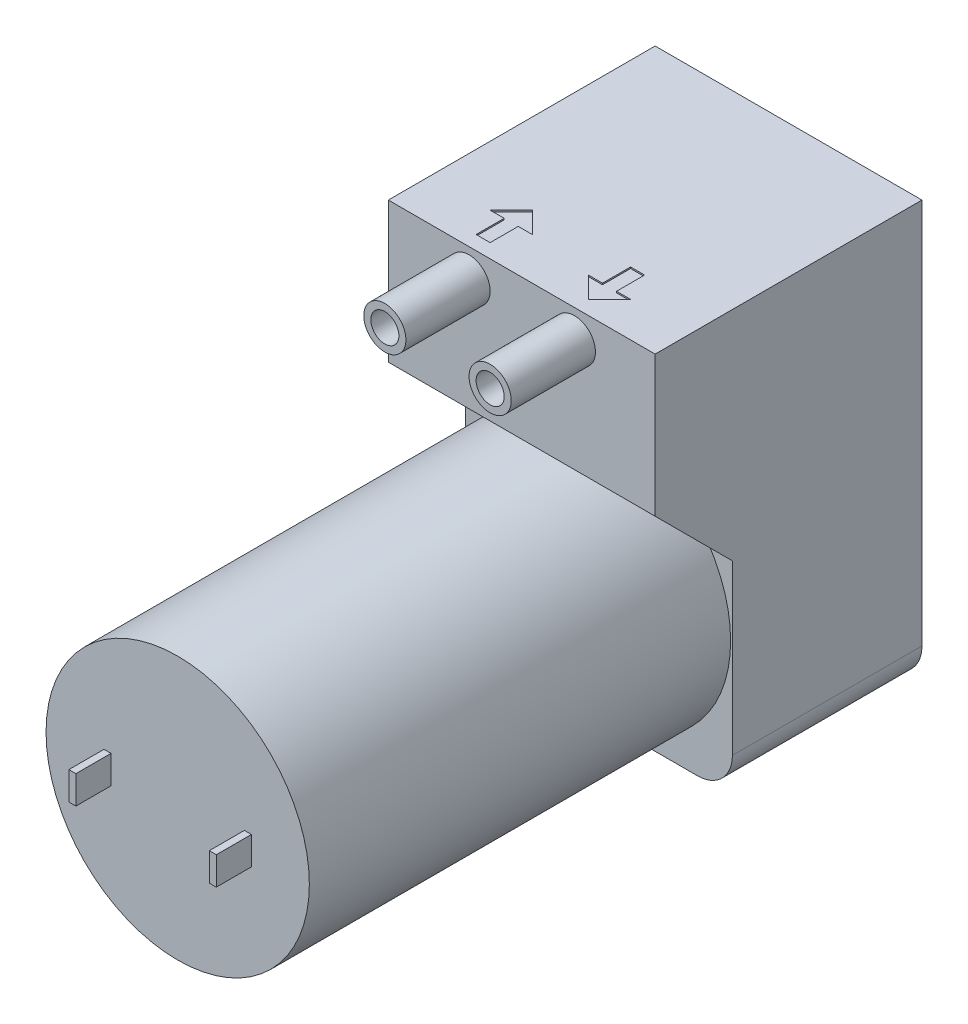
from build123d import *

# Parameters (mm, degrees)
SKETCH1_W      = 38
SKETCH1_H      = 60
EXTRUDE1_DEPTH = 38
EXTRUDE2_DEPTH = 68.594378464
FILLET1_R      = 5
SKETCH3_R      = 18.75
EXTRUDE3_DEPTH = 60
SKETCH4_R      = 3
SKETCH4_R_2    = 2
EXTRUDE4_DEPTH = 12
EXTRUDE5_DEPTH = 0.2
SKETCH6_W      = 1
SKETCH6_H      = 4
EXTRUDE6_DEPTH = 5


with BuildPart() as part:
    # Sketch1 → Extrude1 (new body)
    with BuildSketch(Plane.XY):
        with Locations((0, 11)):
            Rectangle(SKETCH1_W, SKETCH1_H)
    extrude(amount=EXTRUDE1_DEPTH)

    # Sketch2 → Extrude2 (cut, through all)
    with BuildSketch(Plane(origin=(19, 0, 0), x_dir=(0, 0, -1), z_dir=(1, 0, 0))):
        Polygon((-38, -19), (-27, -19), (-27, 10), (-38, 21), align=None)
    extrude(amount=-EXTRUDE2_DEPTH, mode=Mode.SUBTRACT)

    # Fillet1
    fillet1_edges = [part.edges().sort_by_distance(p)[0] for p in [
        (-19, -19, 13.5),
        (19, -19, 13.5),
    ]]
    fillet(fillet1_edges, radius=FILLET1_R)

    # Sketch4 → Extrude4 (add)
    # profile 1 of 2: a face of its own
    with BuildSketch(Plane.XY.offset(38)):
        with Locations(Location((-7.5, 37, 0), (0, 0, 180))):
            Circle(SKETCH4_R)
        with Locations((-7.5, 37)):
            Circle(SKETCH4_R_2, mode=Mode.SUBTRACT)
    # profile 2 of 2: a face of its own
    with BuildSketch(Plane.XY.offset(38)):
        with Locations(Location((7.5, 37, 0), (0, 0, 180))):
            Circle(SKETCH4_R)
        with Locations(Location((7.5, 37, 0), (0, 0, 180))):
            Circle(SKETCH4_R_2, mode=Mode.SUBTRACT)
    extrude(amount=EXTRUDE4_DEPTH)

    # Sketch5 → Extrude5 (cut)
    with BuildSketch(Plane(origin=(0, 41, 0), x_dir=(1, 0, 0), z_dir=(0, 1, 0))):
        Polygon((-8.5, -36), (-8.5, -32), (-10.5, -32), (-7.5, -29), (-4.5, -32), (-6.5, -32), (-6.5, -36), align=None)
        Polygon((6.5, -29), (8.5, -29), (8.5, -33), (10.5, -33), (7.5, -36), (4.5, -33), (6.5, -33), align=None)
    extrude(amount=-EXTRUDE5_DEPTH, mode=Mode.SUBTRACT)


with BuildPart() as body_2:
    # Sketch3 → Extrude3 (new body)
    with BuildSketch(Plane.XY.offset(27)):
        Circle(SKETCH3_R)
    extrude(amount=EXTRUDE3_DEPTH)

    # Sketch6 → Extrude6 (add)
    with BuildSketch(Plane.XY.offset(87)):
        with Locations((-10, 0)):
            Rectangle(SKETCH6_W, SKETCH6_H)
        with Locations((10, 0)):
            Rectangle(SKETCH6_W, SKETCH6_H)
    extrude(amount=EXTRUDE6_DEPTH)


solid = Compound([part.part, body_2.part])
